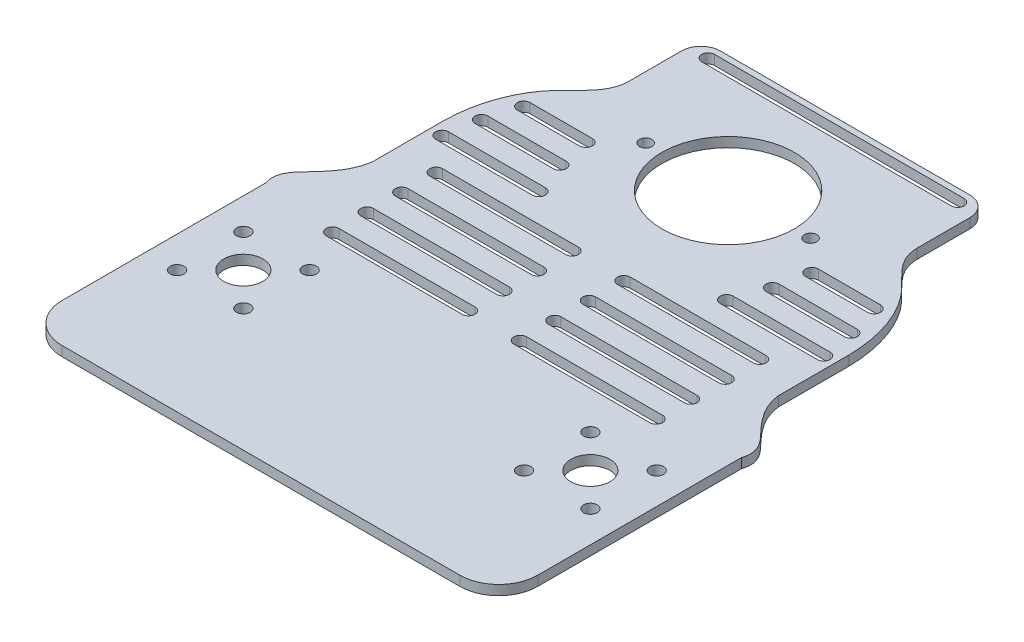
from build123d import *

# Parameters (mm, degrees)
SKETCH_1_R      = 1.75
SKETCH_1_R_2    = 5
SKETCH_1_R_3    = 1.6
EXTRUDE_1_DEPTH = 2.5


with BuildPart() as part:
    # 草图1 → 凸台-拉伸1 (new body)
    with BuildSketch(Plane(origin=(0, 0, 0), x_dir=(1, 0, 0), z_dir=(0, 1, 0))):
        with BuildLine():
            ThreePointArc((-61, -29.99135156), (-58.071067812, -37.062419372), (-51, -39.99135156))
            Line((-51, -39.99135156), (51, -39.99135156))
            ThreePointArc((51, -39.99135156), (58.071067812, -37.062419372), (61, -29.99135156))
            Line((61, -29.99135156), (61, 22.277696204))
            add(Edge.make_bspline(
                [(61, 22.277696204), (62.293823386, 26.079256197), (56.634308682, 31.150713443), (52.485620359, 36.687772359), (52, 40.715903778)],
                knots=[0, 0, 0, 0, 0.462697284, 1, 1, 1, 1], degree=3))
            Line((52, 40.715903778), (52, 58.880539276))
            add(Edge.make_bspline(
                [(52, 58.880539276), (51.906435238, 66.324037), (48.17922794, 79.056777751), (37.094065188, 85.955470032), (37, 91.294061848)],
                knots=[0, 0, 0, 0, 0.617360936, 1, 1, 1, 1], degree=3))
            Line((37, 91.294061848), (37, 104.845172054))
            ThreePointArc((37, 104.845172054), (35.535533906, 108.38070596), (32, 109.845172054))
            Line((32, 109.845172054), (-32, 109.845172054))
            ThreePointArc((-32, 109.845172054), (-35.535533906, 108.38070596), (-37, 104.845172054))
            Line((-37, 104.845172054), (-37, 91.294061848))
            add(Edge.make_bspline(
                [(-52, 58.880539276), (-51.906435238, 66.324037), (-48.17922794, 79.056777751), (-37.094065188, 85.955470032), (-37, 91.294061848)],
                knots=[0, 0, 0, 0, 0.617360936, 1, 1, 1, 1], degree=3))
            Line((-52, 58.880539276), (-52, 40.715903778))
            add(Edge.make_bspline(
                [(-61, 22.277696204), (-62.293823386, 26.079256197), (-56.634308682, 31.150713443), (-52.485620359, 36.687772359), (-52, 40.715903778)],
                knots=[0, 0, 0, 0, 0.462697284, 1, 1, 1, 1], degree=3))
            Line((-61, 22.277696204), (-61, -29.99135156))
        make_face()
        with Locations(Location((-53, -8.5, 0), (0, 0, 270))):
            Circle(SKETCH_1_R, mode=Mode.SUBTRACT)
        with Locations(Location((-44.5, 0, 0), (0, 0, 270))):
            Circle(SKETCH_1_R_2, mode=Mode.SUBTRACT)
        with Locations(Location((-36, -8.5, 0), (0, 0, 270))):
            Circle(SKETCH_1_R, mode=Mode.SUBTRACT)
        with Locations(Location((-53, 8.5, 0), (0, 0, 270))):
            Circle(SKETCH_1_R, mode=Mode.SUBTRACT)
        with Locations(Location((-36, 8.5, 0), (0, 0, 270))):
            Circle(SKETCH_1_R, mode=Mode.SUBTRACT)
        with BuildLine():
            ThreePointArc((-41.5, 18.25), (-43.13586607, 19.88586607), (-41.5, 21.52173214))
            Line((-41.5, 21.52173214), (-6.629379417, 21.52173214))
            ThreePointArc((-6.629379417, 21.52173214), (-4.993513347, 19.88586607), (-6.629379417, 18.25))
            Line((-6.629379417, 18.25), (-41.5, 18.25))
        make_face(mode=Mode.SUBTRACT)
        with BuildLine():
            ThreePointArc((-41.5, 27.1), (-43.13586607, 28.73586607), (-41.5, 30.37173214))
            Line((-41.5, 30.37173214), (-6.629379417, 30.37173214))
            ThreePointArc((-6.629379417, 30.37173214), (-4.993513347, 28.73586607), (-6.629379417, 27.1))
            Line((-6.629379417, 27.1), (-41.5, 27.1))
        make_face(mode=Mode.SUBTRACT)
        with BuildLine():
            ThreePointArc((-41.5, 35.95), (-43.13586607, 37.58586607), (-41.5, 39.22173214))
            Line((-41.5, 39.22173214), (-6.629379417, 39.22173214))
            ThreePointArc((-6.629379417, 39.22173214), (-4.993513347, 37.58586607), (-6.629379417, 35.95))
            Line((-6.629379417, 35.95), (-41.5, 35.95))
        make_face(mode=Mode.SUBTRACT)
        with BuildLine():
            ThreePointArc((-41.5, 44.8), (-43.13586607, 46.43586607), (-41.5, 48.07173214))
            Line((-41.5, 48.07173214), (-6.629379417, 48.07173214))
            ThreePointArc((-6.629379417, 48.07173214), (-4.993513347, 46.43586607), (-6.629379417, 44.8))
            Line((-6.629379417, 44.8), (-41.5, 44.8))
        make_face(mode=Mode.SUBTRACT)
        with Locations(Location((36, -8.5, 0), (0, 0, 270))):
            Circle(SKETCH_1_R, mode=Mode.SUBTRACT)
        with Locations(Location((53, -8.5, 0), (0, 0, 270))):
            Circle(SKETCH_1_R, mode=Mode.SUBTRACT)
        with Locations(Location((44.5, 0, 0), (0, 0, 270))):
            Circle(SKETCH_1_R_2, mode=Mode.SUBTRACT)
        with Locations(Location((36, 8.5, 0), (0, 0, 270))):
            Circle(SKETCH_1_R, mode=Mode.SUBTRACT)
        with Locations(Location((53, 8.5, 0), (0, 0, 270))):
            Circle(SKETCH_1_R, mode=Mode.SUBTRACT)
        with BuildLine():
            Line((6.629379417, 21.52173214), (41.5, 21.52173214))
            ThreePointArc((41.5, 21.52173214), (43.13586607, 19.88586607), (41.5, 18.25))
            Line((41.5, 18.25), (6.629379417, 18.25))
            ThreePointArc((6.629379417, 18.25), (4.993513347, 19.88586607), (6.629379417, 21.52173214))
        make_face(mode=Mode.SUBTRACT)
        with BuildLine():
            Line((6.629379417, 30.37173214), (41.5, 30.37173214))
            ThreePointArc((41.5, 30.37173214), (43.13586607, 28.73586607), (41.5, 27.1))
            Line((41.5, 27.1), (6.629379417, 27.1))
            ThreePointArc((6.629379417, 27.1), (4.993513347, 28.73586607), (6.629379417, 30.37173214))
        make_face(mode=Mode.SUBTRACT)
        with BuildLine():
            Line((6.629379417, 39.22173214), (41.5, 39.22173214))
            ThreePointArc((41.5, 39.22173214), (43.13586607, 37.58586607), (41.5, 35.95))
            Line((41.5, 35.95), (6.629379417, 35.95))
            ThreePointArc((6.629379417, 35.95), (4.993513347, 37.58586607), (6.629379417, 39.22173214))
        make_face(mode=Mode.SUBTRACT)
        with BuildLine():
            Line((6.629379417, 48.07173214), (41.5, 48.07173214))
            ThreePointArc((41.5, 48.07173214), (43.13586607, 46.43586607), (41.5, 44.8))
            Line((41.5, 44.8), (6.629379417, 44.8))
            ThreePointArc((6.629379417, 44.8), (4.993513347, 46.43586607), (6.629379417, 48.07173214))
        make_face(mode=Mode.SUBTRACT)
        with BuildLine():
            ThreePointArc((-48.931385346, 53.73119276), (-50.581385346, 55.38119276), (-48.931385346, 57.03119276))
            Line((-48.931385346, 57.03119276), (-24.064689708, 57.03119276))
            ThreePointArc((-24.064689708, 57.03119276), (-22.414689708, 55.38119276), (-24.064689708, 53.73119276))
            Line((-24.064689708, 53.73119276), (-48.931385346, 53.73119276))
        make_face(mode=Mode.SUBTRACT)
        with BuildLine():
            Line((-47.365035435, 65.58311996), (-27.274768907, 65.58311996))
            ThreePointArc((-27.274768907, 65.58311996), (-25.624768907, 63.93311996), (-27.274768907, 62.28311996))
            Line((-27.274768907, 62.28311996), (-47.365035435, 62.28311996))
            ThreePointArc((-47.365035435, 62.28311996), (-49.015035435, 63.93311996), (-47.365035435, 65.58311996))
        make_face(mode=Mode.SUBTRACT)
        with BuildLine():
            Line((-44.932457044, 73.982304528), (-28.97899618, 73.982304528))
            ThreePointArc((-28.97899618, 73.982304528), (-27.32899618, 72.332304528), (-28.97899618, 70.682304528))
            Line((-28.97899618, 70.682304528), (-44.932457044, 70.682304528))
            ThreePointArc((-44.932457044, 70.682304528), (-46.582457044, 72.332304528), (-44.932457044, 73.982304528))
        make_face(mode=Mode.SUBTRACT)
        with Locations(Location((-21.145483371, 79.821873209, 0), (0, 0, 270))):
            Circle(SKETCH_1_R_3, mode=Mode.SUBTRACT)
        with BuildLine():
            Line((32, 105.037777769), (0, 105.037777769))
            Line((0, 105.037777769), (-32, 105.037777769))
            ThreePointArc((-32, 105.037777769), (-33.65, 106.687777769), (-32, 108.337777769))
            Line((-32, 108.337777769), (32, 108.337777769))
            ThreePointArc((32, 108.337777769), (33.65, 106.687777769), (32, 105.037777769))
        make_face(mode=Mode.SUBTRACT)
        with BuildLine():
            Line((24.064689708, 57.03119276), (48.931385346, 57.03119276))
            ThreePointArc((48.931385346, 57.03119276), (50.581385346, 55.38119276), (48.931385346, 53.73119276))
            Line((48.931385346, 53.73119276), (24.064689708, 53.73119276))
            ThreePointArc((24.064689708, 53.73119276), (22.414689708, 55.38119276), (24.064689708, 57.03119276))
        make_face(mode=Mode.SUBTRACT)
        with BuildLine():
            Line((27.274768907, 65.58311996), (47.365035435, 65.58311996))
            ThreePointArc((47.365035435, 65.58311996), (49.015035435, 63.93311996), (47.365035435, 62.28311996))
            Line((47.365035435, 62.28311996), (27.274768907, 62.28311996))
            ThreePointArc((27.274768907, 62.28311996), (25.624768907, 63.93311996), (27.274768907, 65.58311996))
        make_face(mode=Mode.SUBTRACT)
        with BuildLine():
            Line((44.932457044, 70.682304528), (28.97899618, 70.682304528))
            ThreePointArc((28.97899618, 70.682304528), (27.32899618, 72.332304528), (28.97899618, 73.982304528))
            Line((28.97899618, 73.982304528), (44.932457044, 73.982304528))
            ThreePointArc((44.932457044, 73.982304528), (46.582457044, 72.332304528), (44.932457044, 70.682304528))
        make_face(mode=Mode.SUBTRACT)
        with BuildLine():
            ThreePointArc((0, 62.821873209), (-17, 79.821873209), (0, 96.821873209))
            ThreePointArc((0, 96.821873209), (17, 79.821873209), (0, 62.821873209))
        make_face(mode=Mode.SUBTRACT)
        with Locations(Location((21.145483371, 79.821873209, 0), (0, 0, 270))):
            Circle(SKETCH_1_R_3, mode=Mode.SUBTRACT)
    extrude(amount=EXTRUDE_1_DEPTH)


solid = part.part
